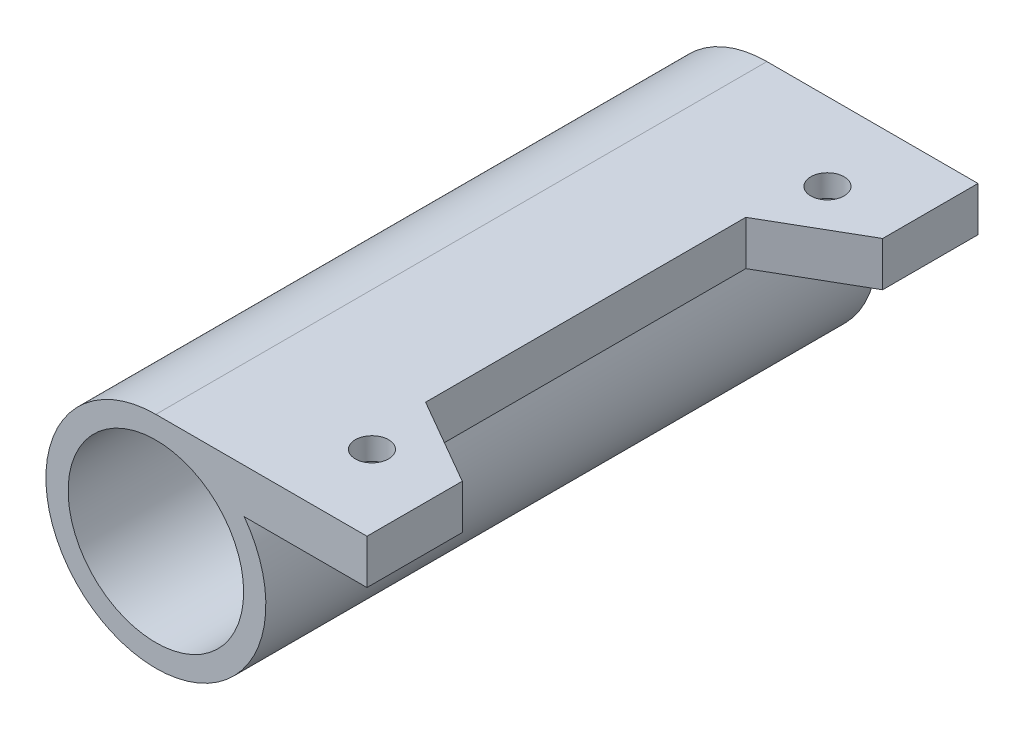
from build123d import *

# Parameters (mm, degrees)
EXTRUDE_1_DEPTH      = 48
EXTRUDE_1_DEPTH_BACK = 7
SKETCH_2_R           = 9.9
SKETCH_2_R_2         = 7.9
CUT_EXTRUDE_1_DEPTH  = 2
SKETCH_4_R           = 1.5
CUT_EXTRUDE_2_DEPTH  = 10
CUT_EXTRUDE_3_DEPTH  = 10


with BuildPart() as part:
    # Эскиз2 → Бобышка-Вытянуть1 (new, two sides: drawn at the far end of the back side and taken through both)
    # profile 1 of 2: a face of its own
    with BuildSketch(Plane.XY.offset(-EXTRUDE_1_DEPTH_BACK)):
        Circle(SKETCH_2_R)
        Circle(SKETCH_2_R_2, mode=Mode.SUBTRACT)
    # profile 2 of 2: a face of its own
    with BuildSketch(Plane.XY.offset(-EXTRUDE_1_DEPTH_BACK)):
        with BuildLine():
            Line((19, 9.9), (0, 9.9))
            ThreePointArc((0, 9.9), (4.449719092, 8.843641784), (7.949842766, 5.9))
            Line((7.949842766, 5.9), (19, 5.9))
            Line((19, 5.9), (19, 9.9))
        make_face()
    extrude(amount=EXTRUDE_1_DEPTH + EXTRUDE_1_DEPTH_BACK)

    # Эскиз3 → Вырез-Вытянуть1 (cut)
    with BuildSketch(Plane.XZ.offset(-5.9)):
        Polygon((15.449842766, -1.732050808), (15.449842766, 1.732050808), (12.449842766, 3.464101615), (9.449842766, 1.732050808), (9.449842766, -1.732050808), (12.449842766, -3.464101615), align=None)
        Polygon((12.449842766, 44.464101615), (15.449842766, 42.732050808), (15.449842766, 39.267949192), (12.449842766, 37.535898385), (9.449842766, 39.267949192), (9.449842766, 42.732050808), align=None)
    extrude(amount=-CUT_EXTRUDE_1_DEPTH, mode=Mode.SUBTRACT)

    # Эскиз4 → Вырез-Вытянуть2 (cut)
    with BuildSketch(Plane(origin=(0, 9.9, 0), x_dir=(1, 0, 0), z_dir=(0, 1, 0))):
        with Locations(Location((12.449842766, 0, 0), (0, 0, 270))):
            Circle(SKETCH_4_R)
        with Locations(Location((12.449842766, -41, 0), (0, 0, 270))):
            Circle(SKETCH_4_R)
    extrude(amount=-CUT_EXTRUDE_2_DEPTH, mode=Mode.SUBTRACT)

    # Эскиз5 → Вырез-Вытянуть3 (cut)
    with BuildSketch(Plane(origin=(0, 9.9, 0), x_dir=(1, 0, 0), z_dir=(0, 1, 0))):
        Polygon((19, -1.578851944), (11.190820694, -6.087483718), (11.190820694, -34.912516282), (19, -39.421148056), align=None)
    extrude(amount=-CUT_EXTRUDE_3_DEPTH, mode=Mode.SUBTRACT)


solid = part.part
